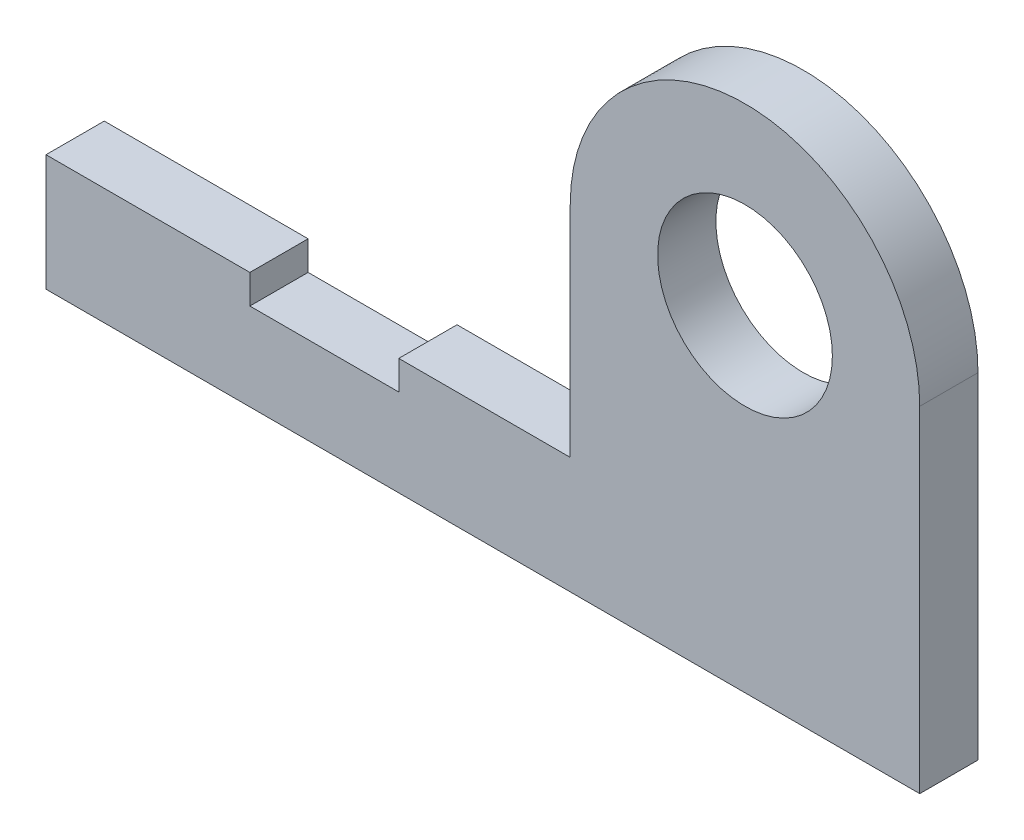
from build123d import *

# Parameters (mm, degrees)
SKETCH1_R           = 15
BOSS_EXTRUDE3_DEPTH = 5


with BuildPart() as part:
    # Sketch1 → Boss-Extrude3 (new, symmetric)
    with BuildSketch(Plane.XY):
        with BuildLine():
            Line((0, 0), (0, 20))
            Line((0, 20), (35, 20))
            Line((35, 20), (35, 15))
            Line((35, 15), (60.563909774, 15))
            Line((60.563909774, 15), (60.563909774, 20))
            Line((60.563909774, 20), (90, 20))
            Line((90, 20), (90, 57.593984962))
            ThreePointArc((90, 57.593984962), (120, 87.593984962), (150, 57.593984962))
            Line((150, 57.593984962), (150, 0))
            Line((150, 0), (0, 0))
        make_face()
        with Locations((120, 57.593984962)):
            Circle(SKETCH1_R, mode=Mode.SUBTRACT)
    extrude(amount=BOSS_EXTRUDE3_DEPTH, both=True)


solid = part.part
